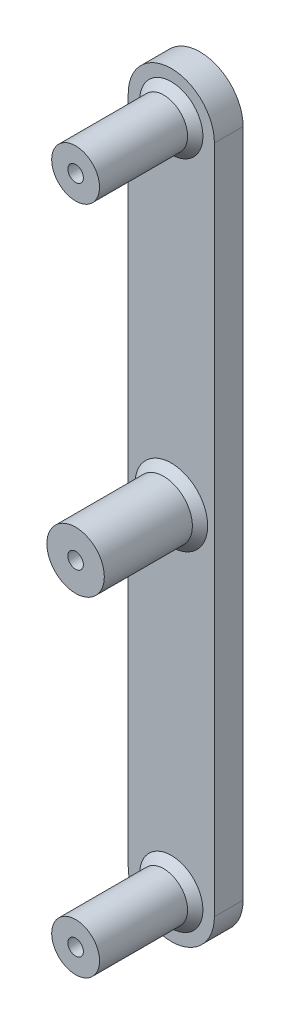
from build123d import *

# Parameters (mm, degrees)
SKETCH1_R             = 2.5
BOSS_EXTRUDE1_DEPTH   = 10
BOSS_EXTRUDE1_2_DEPTH = 10
BOSS_EXTRUDE2_DEPTH   = 3
SKETCH3_R             = 0.8125
CUT_EXTRUDE1_DEPTH    = 20
CHAMFER1_SIZE         = 0.8
SKETCH4_R             = 3
BOSS_EXTRUDE3_DEPTH   = 10
CHAMFER2_SIZE         = 0.8
SKETCH5_R             = 0.8125
CUT_EXTRUDE2_DEPTH    = 20


with BuildPart() as part:
    # Sketch1 → Boss-Extrude1 (new body)
    with BuildSketch(Plane(origin=(0, 0, 0), x_dir=(0, 1, 0), z_dir=(0, 0, 1))):
        with Locations((-35, 0)):
            Circle(SKETCH1_R)
    extrude(amount=BOSS_EXTRUDE1_DEPTH)



with BuildPart() as body_2:
    # Sketch1 → Boss-Extrude1 2 (new body)
    with BuildSketch(Plane(origin=(0, 0, 0), x_dir=(0, 1, 0), z_dir=(0, 0, 1))):
        with Locations((35, 0)):
            Circle(SKETCH1_R)
    extrude(amount=BOSS_EXTRUDE1_2_DEPTH)


with BuildPart() as part_1:
    add(part.part)

    add(body_2.part)  # Boss-Extrude2 merges body 2
    # Sketch2 → Boss-Extrude2 (add)
    with BuildSketch(Plane(origin=(0, 0, 0), x_dir=(1, 0, 0), z_dir=(0, 0, -1))):
        with BuildLine():
            Line((4.5, 35), (4.5, -35))
            ThreePointArc((4.5, -35), (0, -39.5), (-4.5, -35))
            Line((-4.5, -35), (-4.5, 35))
            ThreePointArc((-4.5, 35), (0, 39.5), (4.5, 35))
        make_face()
    extrude(amount=BOSS_EXTRUDE2_DEPTH)

    # Sketch3 → Cut-Extrude1 (cut)
    with BuildSketch(Plane.XY.offset(10)):
        with Locations((0, -35)):
            Circle(SKETCH3_R)
        with Locations((0, 35)):
            Circle(SKETCH3_R)
    extrude(amount=-CUT_EXTRUDE1_DEPTH, mode=Mode.SUBTRACT)

    # Chamfer1
    chamfer1_edges = [part_1.edges().sort_by_distance(p)[0] for p in [
        (0, 32.5, 0),
        (0, -37.5, 0),
    ]]
    chamfer(chamfer1_edges, length=CHAMFER1_SIZE)

    # Sketch4 → Boss-Extrude3 (add)
    with BuildSketch(Plane.XY):
        with Locations(Location((0, 0, 0), (0, 0, 180))):
            Circle(SKETCH4_R)
    extrude(amount=BOSS_EXTRUDE3_DEPTH)

    # Chamfer2
    chamfer2_edges = [part_1.edges().sort_by_distance(p)[0] for p in [
        (3, 0, 0),
    ]]
    chamfer(chamfer2_edges, length=CHAMFER2_SIZE)

    # Sketch5 → Cut-Extrude2 (cut)
    with BuildSketch(Plane.XY.offset(10)):
        Circle(SKETCH5_R)
    extrude(amount=-CUT_EXTRUDE2_DEPTH, mode=Mode.SUBTRACT)


solid = part_1.part
